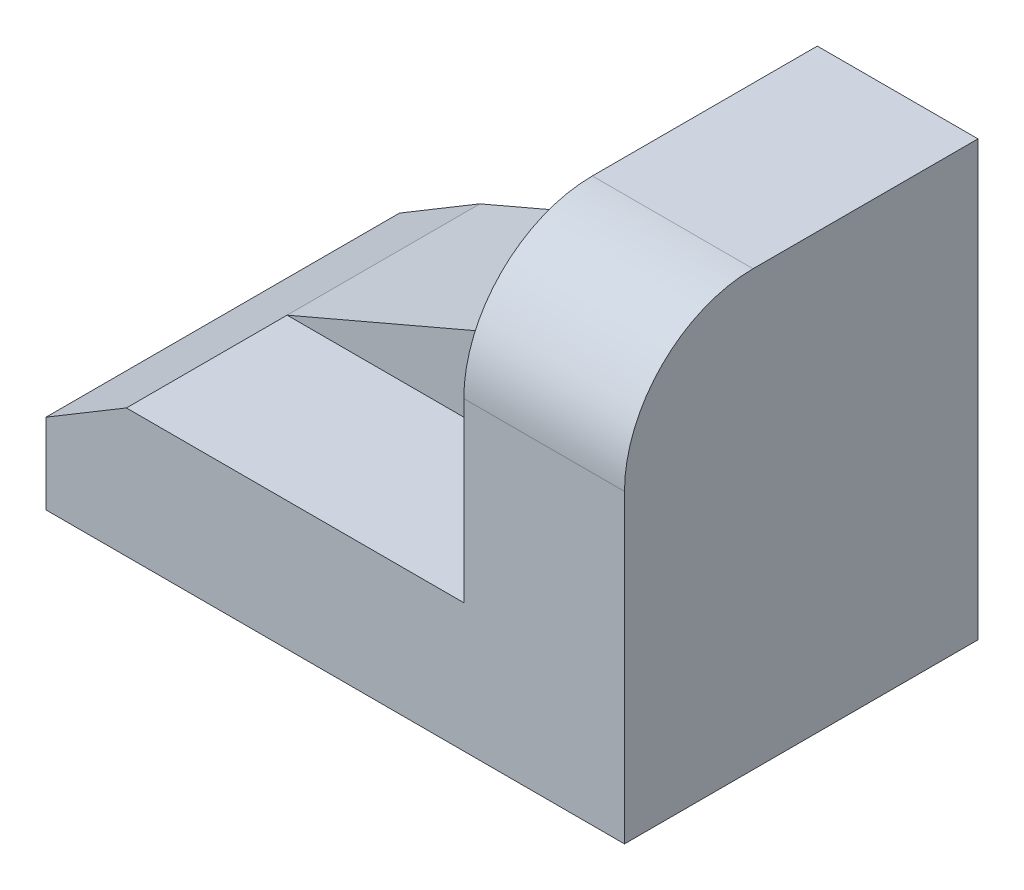
from build123d import *

# Parameters (mm, degrees)
BOSS_EXTRUDE1_DEPTH = 22000
CUT_EXTRUDE1_DEPTH  = 22000
BOSS_EXTRUDE2_DEPTH = 12000


with BuildPart() as part:
    # Sketch2 → Boss-Extrude1 (new body)
    with BuildSketch(Plane.XY):
        Polygon((0, 0), (36000, 0), (36000, 27000), (26000, 27000), (26000, 8000), (5004.228184677, 8000), (0, 5000), align=None)
    extrude(amount=BOSS_EXTRUDE1_DEPTH)

    # Sketch3 → Cut-Extrude1 (cut)
    with BuildSketch(Plane(origin=(36000, 0, 0), x_dir=(0, 0, -1), z_dir=(1, 0, 0))):
        with BuildLine():
            Line((-22000, 19000), (-22000, 27000))
            Line((-22000, 27000), (-14000, 27000))
            ThreePointArc((-14000, 27000), (-19656.854249492, 24656.854249492), (-22000, 19000))
        make_face()
    extrude(amount=-CUT_EXTRUDE1_DEPTH, mode=Mode.SUBTRACT)

    # Sketch4 → Boss-Extrude2 (add)
    with BuildSketch(Plane(origin=(0, 0, 0), x_dir=(-1, 0, 0), z_dir=(0, 0, -1))):
        Polygon((-5004.228184677, 8000), (-26000, 8000), (-26000, 17000), align=None)
    extrude(amount=-BOSS_EXTRUDE2_DEPTH)


solid = part.part
